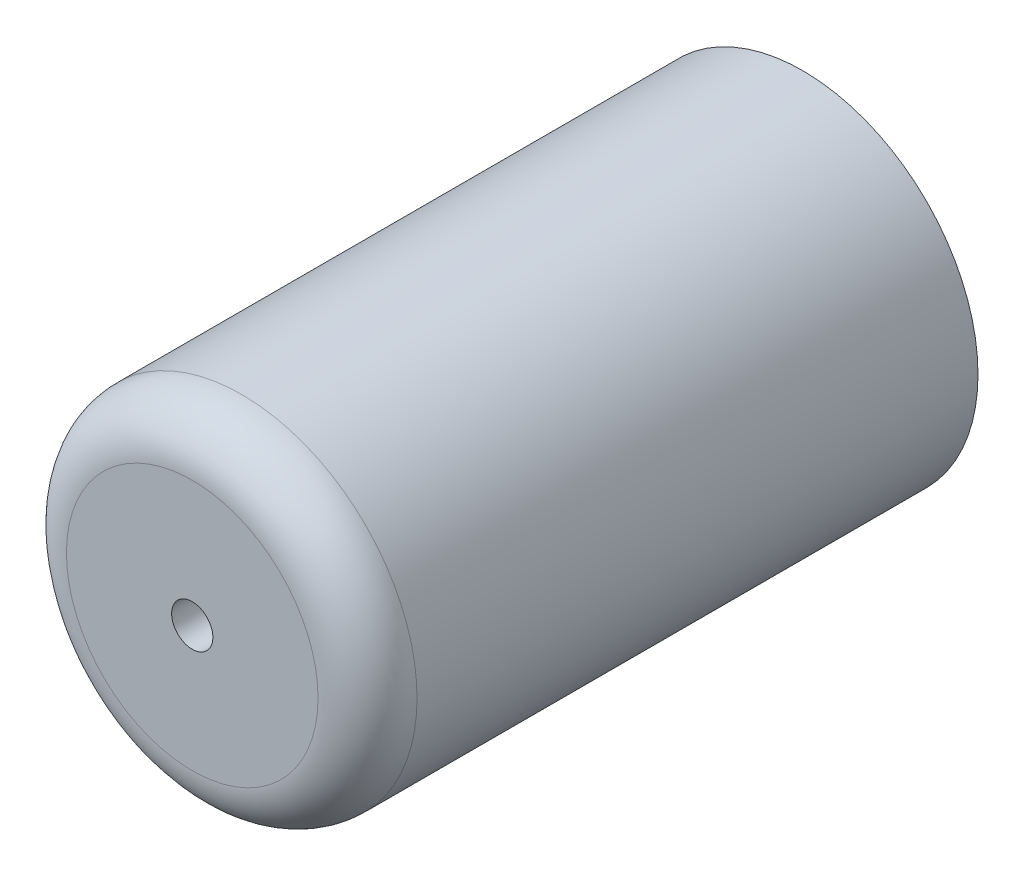
from build123d import *

# Parameters (mm, degrees)
SKETCH1_R           = 21.25
SKETCH1_R_2         = 2.5
BOSS_EXTRUDE1_DEPTH = 74
FILLET1_R           = 6
SKETCH2_R           = 17.145
SKETCH2_R_2         = 4.445
CUT_EXTRUDE1_DEPTH  = 65


with BuildPart() as part:
    # Sketch1 → Boss-Extrude1 (new body)
    with BuildSketch(Plane.XY):
        Circle(SKETCH1_R)
        Circle(SKETCH1_R_2, mode=Mode.SUBTRACT)
    extrude(amount=BOSS_EXTRUDE1_DEPTH)

    # Fillet1
    fillet1_edges = [part.edges().sort_by_distance(p)[0] for p in [
        (-21.25, 0, 74),
    ]]
    fillet(fillet1_edges, radius=FILLET1_R)

    # Sketch2 → Cut-Extrude1 (cut)
    with BuildSketch(Plane(origin=(0, 0, 0), x_dir=(-1, 0, 0), z_dir=(0, 0, -1))):
        Circle(SKETCH2_R)
        Circle(SKETCH2_R_2, mode=Mode.SUBTRACT)
    extrude(amount=-CUT_EXTRUDE1_DEPTH, mode=Mode.SUBTRACT)


solid = part.part
